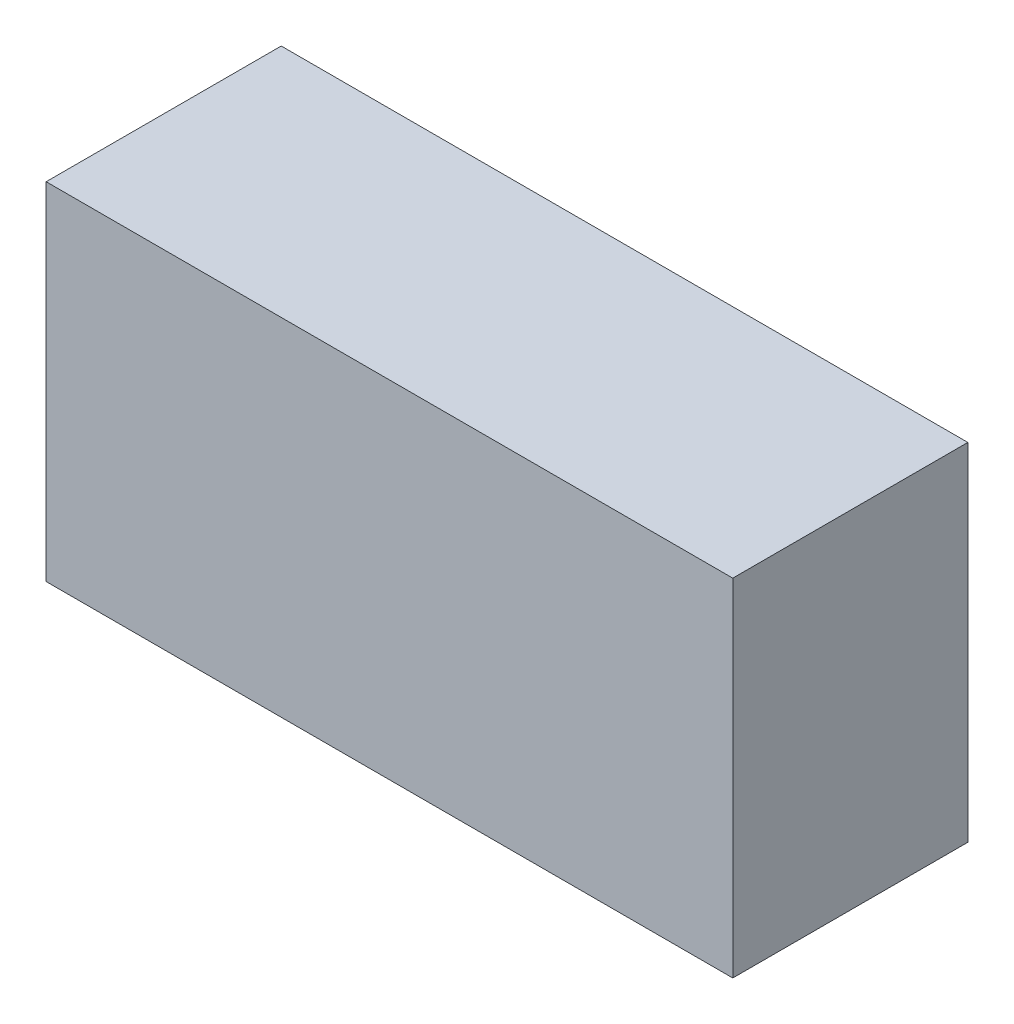
from build123d import *

# Parameters (mm, degrees)
SKETCH1_W               = 2.921
SKETCH1_H               = 1.4732
COMPONENT_OUTLINE_DEPTH = 1


with BuildPart() as part:
    # Sketch1 → Component_Outline (new body)
    with BuildSketch(Plane.XY):
        with Locations((0.0381, 0)):
            Rectangle(SKETCH1_W, SKETCH1_H)
    extrude(amount=COMPONENT_OUTLINE_DEPTH)


solid = part.part
